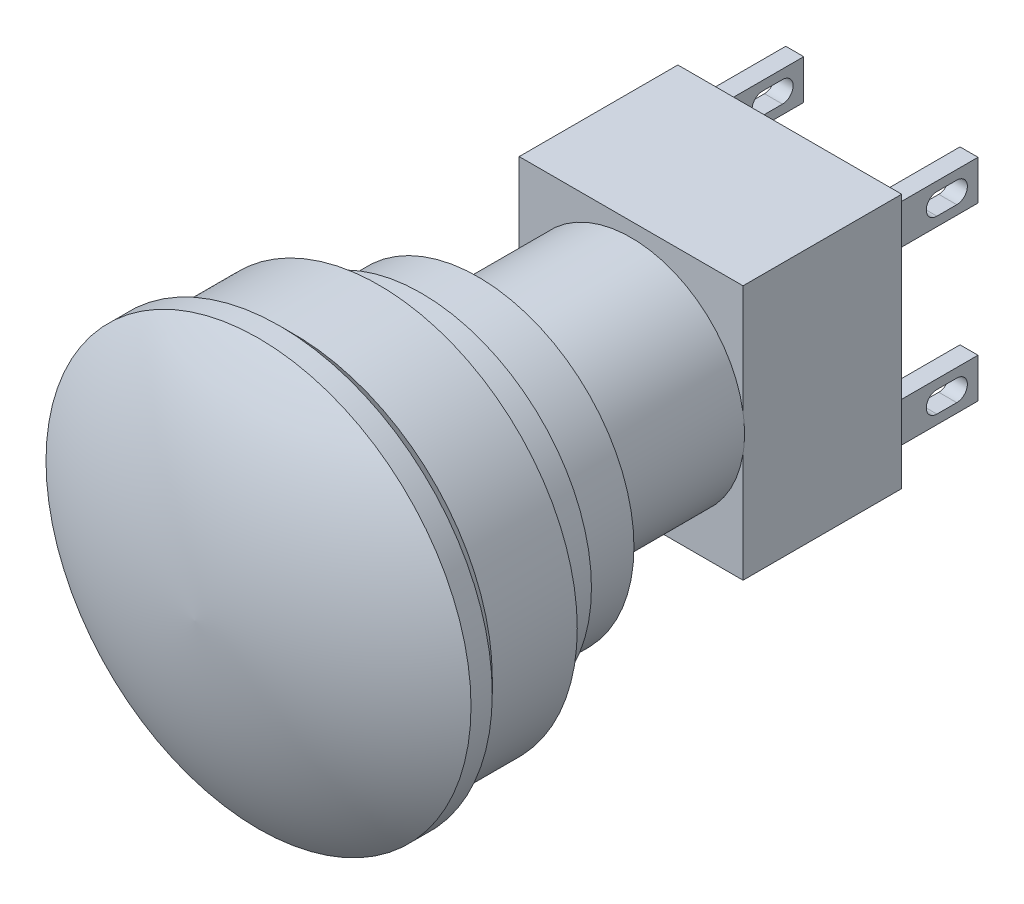
from build123d import *

# Parameters (mm, degrees)
SKETCH2_W           = 15.8
SKETCH2_H           = 18
BOSS_EXTRUDE2_DEPTH = 11.2
SKETCH3_W           = 1.27
SKETCH3_H           = 6.5
BOSS_EXTRUDE3_DEPTH = 18
SKETCH4_W           = 6.5
SKETCH4_H           = 1.55
SKETCH4_H_2         = 9.3
CUT_EXTRUDE1_DEPTH  = 52.337960929
CUT_EXTRUDE2_DEPTH  = 52.337960929


with BuildPart() as part:
    # Sketch1 → Revolve1 (revolve)
    with BuildSketch(Plane(origin=(0, 0, 0), x_dir=(0, 0, -1), z_dir=(1, 0, 0)), mode=Mode.PRIVATE) as revolve1_sk:
        with BuildLine():
            Line((0, 15), (1.5, 15))
            Line((1.5, 15), (2.5, 14))
            Line((2.5, 14), (8.5, 14))
            Line((8.5, 14), (9.5, 12))
            Line((9.5, 12), (11.5, 12))
            Line((11.5, 12), (11.5, 11))
            Line((11.5, 11), (15.5, 11))
            Line((15.5, 11), (15.5, 8))
            Line((15.5, 8), (26.3, 8))
            Line((26.3, 8), (26.3, 0))
            Line((26.3, 0), (-4.5, 0))
            add(Edge.make_bspline(
                [(-4.5, 0), (-4.300353952, 5.255228693), (-2.977309479, 10.604163614), (0, 15)],
                knots=[0, 0, 0, 0, 1, 1, 1, 1], degree=3))
        make_face()
    revolve(revolve1_sk.sketch.rotate(Axis((0, 0, 0), (0, 0, -1)), 90), axis=Axis((0, 0, 0), (0, 0, -1)))

    # Sketch2 → Boss-Extrude2 (add)
    with BuildSketch(Plane(origin=(0, 0, -26.3), x_dir=(-1, 0, 0), z_dir=(0, 0, -1))):
        Rectangle(SKETCH2_W, SKETCH2_H)
    extrude(amount=BOSS_EXTRUDE2_DEPTH)

    # Sketch3 → Boss-Extrude3 (add)
    with BuildSketch(Plane(origin=(0, 9, 0), x_dir=(1, 0, 0), z_dir=(0, 1, 0))):
        with Locations((-6.15, 40.75)):
            Rectangle(SKETCH3_W, SKETCH3_H)
        with Locations((6.15, 40.75)):
            Rectangle(SKETCH3_W, SKETCH3_H)
    extrude(amount=-BOSS_EXTRUDE3_DEPTH)

    # Sketch4 → Cut-Extrude1 (cut, through all)
    with BuildSketch(Plane(origin=(6.785, 0, 0), x_dir=(0, 0, -1), z_dir=(1, 0, 0))):
        with Locations((40.75, 8.225)):
            Rectangle(SKETCH4_W, SKETCH4_H)
        with Locations((40.75, 0)):
            Rectangle(SKETCH4_W, SKETCH4_H_2)
        with Locations((40.75, -8.225)):
            Rectangle(SKETCH4_W, SKETCH4_H)
    extrude(amount=-CUT_EXTRUDE1_DEPTH, mode=Mode.SUBTRACT)

    # Sketch5 → Cut-Extrude2 (cut, through all)
    with BuildSketch(Plane(origin=(6.785, 0, 0), x_dir=(0, 0, -1), z_dir=(1, 0, 0))):
        with BuildLine():
            Line((41.1, 6.8), (42.5, 6.8))
            ThreePointArc((42.5, 6.8), (43.25, 6.05), (42.5, 5.3))
            Line((42.5, 5.3), (41.1, 5.3))
            ThreePointArc((41.1, 5.3), (40.35, 6.05), (41.1, 6.8))
        make_face()
    cut_extrude2 = extrude(amount=-CUT_EXTRUDE2_DEPTH, mode=Mode.SUBTRACT)

    # Mirror1: Cut-Extrude2 across plane
    add(cut_extrude2.mirror(Plane.ZX), mode=Mode.SUBTRACT)


solid = part.part
